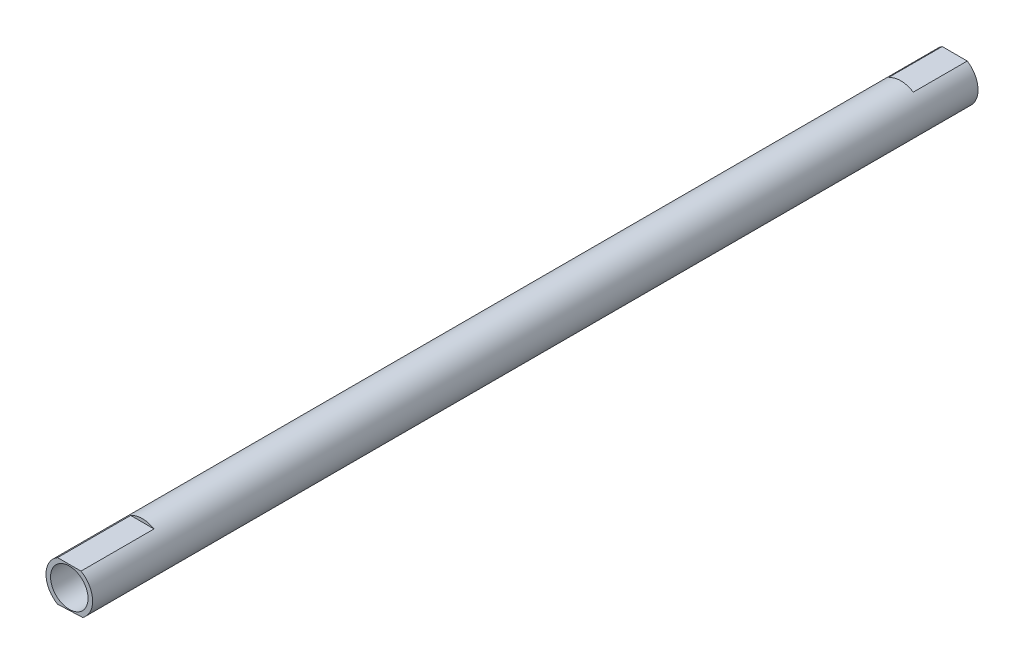
from build123d import *

# Parameters (mm, degrees)
SKETCH2_R           = 13.383565171
SKETCH2_R_2         = 10.769869961
BOSS_EXTRUDE1_DEPTH = 508
CUT_EXTRUDE1_START  = -41.91
CUT_EXTRUDE1_DEPTH  = 41.91
CUT_EXTRUDE2_DEPTH  = 30.988


with BuildPart() as part:
    # Sketch2 → Boss-Extrude1 (new body)
    with BuildSketch(Plane.XY):
        Circle(SKETCH2_R)
        Circle(SKETCH2_R_2, mode=Mode.SUBTRACT)
    extrude(amount=BOSS_EXTRUDE1_DEPTH)

    # Sketch3 → Cut-Extrude1 (cut)
    with BuildSketch(Plane.XY.offset(508).offset(CUT_EXTRUDE1_START)):
        with BuildLine():
            ThreePointArc((6.70741417, 11.581468466), (0, 13.383565171), (-6.70741417, 11.581468466))
            Line((-6.70741417, 11.581468466), (6.70741417, 11.581468466))
        make_face()
        with BuildLine():
            Line((7.648089194, -10.983011807), (-6.70741417, -11.581468466))
            ThreePointArc((-6.70741417, -11.581468466), (0.557454006, -13.371950557), (7.648089194, -10.983011807))
        make_face()
    extrude(amount=CUT_EXTRUDE1_DEPTH, mode=Mode.SUBTRACT)

    # Sketch4 → Cut-Extrude2 (cut)
    with BuildSketch(Plane(origin=(0, 0, 0), x_dir=(-1, 0, 0), z_dir=(0, 0, -1))):
        with BuildLine():
            ThreePointArc((7.196946438, 11.28378388), (0, 13.383565171), (-7.196946438, 11.28378388))
            Line((-7.196946438, 11.28378388), (7.196946438, 11.28378388))
        make_face()
        with BuildLine():
            Line((7.820080378, -10.861222747), (-7.196946438, -11.28378388))
            ThreePointArc((-7.196946438, -11.28378388), (0.376448475, -13.378269814), (7.820080378, -10.861222747))
        make_face()
    extrude(amount=-CUT_EXTRUDE2_DEPTH, mode=Mode.SUBTRACT)


solid = part.part
